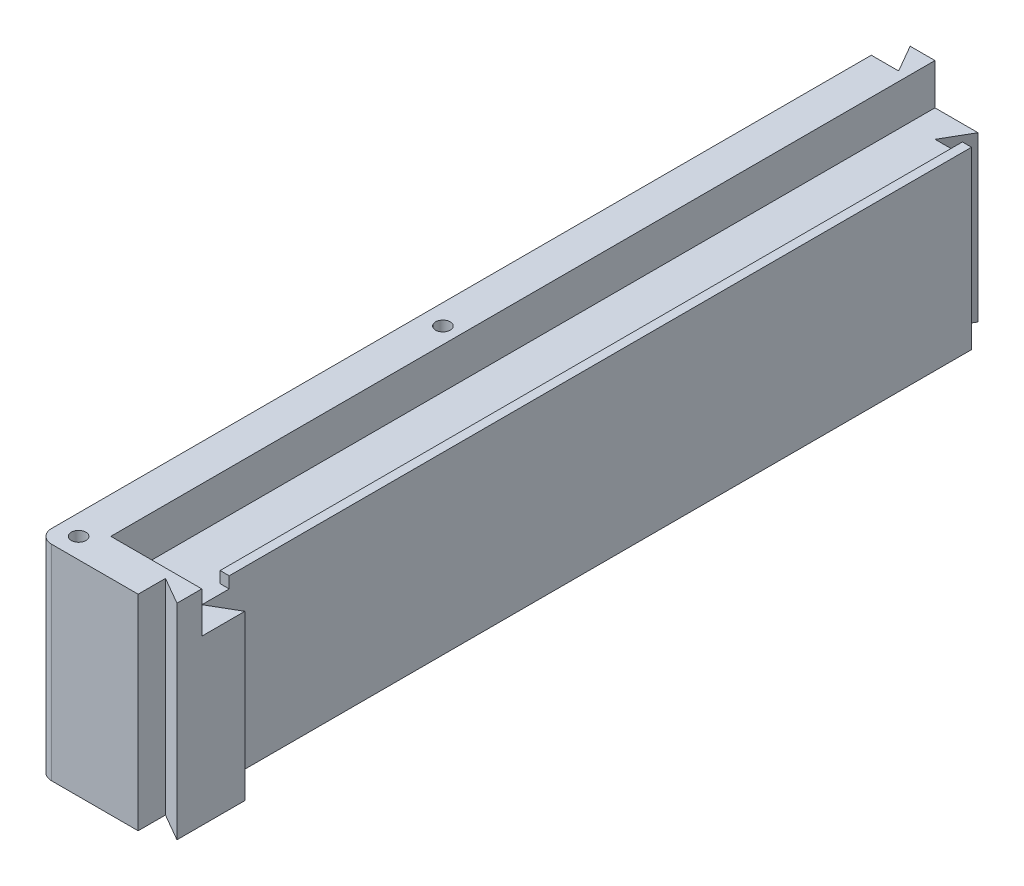
from build123d import *

# Parameters (mm, degrees)
SKETCH_1_W                = 270
SKETCH_1_H                = 370
SKETCH_1_W_2              = 250
SKETCH_1_H_2              = 350
EXTRUDE_2_DEPTH           = 45
SKETCH_4_W                = 250
SKETCH_4_H                = 350
SKETCH_4_W_2              = 222
SKETCH_4_H_2              = 322
EXTRUDE_3_DEPTH           = 5
SKETCH_9_W                = 246
SKETCH_9_H                = 346
SKETCH_9_W_2              = 226
SKETCH_9_H_2              = 326
CUT_EXTRUDE_3_DEPTH       = 2.5
SKETCH_12_R               = 1.6
CUT_EXTRUDE_5_DEPTH       = 109.5
FILLET_1_R                = 5
SKETCH_13_W               = 250
SKETCH_13_H               = 350
SKETCH_13_W_2             = 222
SKETCH_13_H_2             = 322
EXTRUDE_4_DEPTH           = 33.5
CUT_EXTRUDE_START         = -126.5
SKETCH_14_R               = 1.6
CUT_EXTRUDE_9_DEPTH       = 126.5
SKETCH_15_R               = 1.6
CUT_EXTRUDE_10_DEPTH      = 50
CUT_EXTRUDE_11_DEPTH      = 2.5
CUT_EXTRUDE_12_DEPTH      = 188.55314569
CUT_EXTRUDE_12_DEPTH_BACK = 188.55314569


with BuildPart() as part:
    # 草图1 → 凸台-拉伸2 (new body)
    with BuildSketch(Plane(origin=(0, 0, 0), x_dir=(1, 0, 0), z_dir=(0, 1, 0))):
        with Locations((125, 175)):
            Rectangle(SKETCH_1_W, SKETCH_1_H)
        with Locations((125, 175)):
            Rectangle(SKETCH_1_W_2, SKETCH_1_H_2, mode=Mode.SUBTRACT)
    extrude(amount=EXTRUDE_2_DEPTH)

    # 草图4 → 凸台-拉伸3 (add)
    with BuildSketch(Plane(origin=(0, 38.5, 0), x_dir=(1, 0, 0), z_dir=(0, 1, 0))):
        with Locations((125, 175)):
            Rectangle(SKETCH_4_W, SKETCH_4_H)
        with Locations((125, 175)):
            Rectangle(SKETCH_4_W_2, SKETCH_4_H_2, mode=Mode.SUBTRACT)
    extrude(amount=-EXTRUDE_3_DEPTH)

    # 草图9 → 切除-拉伸3 (cut)
    with BuildSketch(Plane(origin=(0, 38.5, 0), x_dir=(1, 0, 0), z_dir=(0, 1, 0))):
        with Locations((125, 175)):
            Rectangle(SKETCH_9_W, SKETCH_9_H)
        with Locations((125, 175)):
            Rectangle(SKETCH_9_W_2, SKETCH_9_H_2, mode=Mode.SUBTRACT)
    extrude(amount=-CUT_EXTRUDE_3_DEPTH, mode=Mode.SUBTRACT)

    # 草图12 → 切除-拉伸5 (cut)
    with BuildSketch(Plane(origin=(0, 45, 0), x_dir=(1, 0, 0), z_dir=(0, 1, 0))):
        with Locations(Location((-3.535533906, -3.535533906, 0), (0, 0, 270))):
            Circle(SKETCH_12_R)
        with BuildLine():
            ThreePointArc((-4.666904756, 354.666904756), (-4.666904756, 352.404163056), (-2.404163056, 352.404163056))
            Line((-2.404163056, 352.404163056), (-4.666904756, 354.666904756))
        make_face()
        with BuildLine():
            Line((-4.666904756, 354.666904756), (-2.404163056, 352.404163056))
            ThreePointArc((-2.404163056, 352.404163056), (-2.057326654, 352.923240414), (-1.935533906, 353.535533906))
            ThreePointArc((-1.935533906, 353.535533906), (-2.923240414, 355.013741158), (-4.666904756, 354.666904756))
        make_face()
        with Locations(Location((253.535533906, 353.535533906, 0), (0, 0, 270))):
            Circle(SKETCH_12_R)
        with Locations(Location((253.535533906, -3.535533906, 0), (0, 0, 270))):
            Circle(SKETCH_12_R)
    extrude(amount=-CUT_EXTRUDE_5_DEPTH, mode=Mode.SUBTRACT)

    # 圆角1
    fillet_1_edges = [part.edges().sort_by_distance(p)[0] for p in [
        (-10, 22.5, 10),
        (-10, 22.5, -360),
        (260, 22.5, -360),
        (260, 22.5, 10),
    ]]
    fillet(fillet_1_edges, radius=FILLET_1_R)

    # 草图13 → 凸台-拉伸4 (add)
    with BuildSketch(Plane.XZ.offset(-33.5)):
        with Locations((125, -175)):
            Rectangle(SKETCH_13_W, SKETCH_13_H)
        with Locations((125, -175)):
            Rectangle(SKETCH_13_W_2, SKETCH_13_H_2, mode=Mode.SUBTRACT)
    extrude(amount=EXTRUDE_4_DEPTH)

    # 草图14 → 切除-拉伸9 (cut)
    # profile 1 of 8: a face of its own
    with BuildSketch(Plane.XZ.offset(CUT_EXTRUDE_START)):
        with BuildLine():
            Line((14, -336), (14, -175))
            Line((14, -175), (6, -175))
            Line((6, -175), (9.45, -180.975575286))
            Line((9.45, -180.975575286), (-5.45, -180.975575286))
            Line((-5.45, -180.975575286), (-2, -175))
            Line((-2, -175), (-10, -175))
            Line((-10, -175), (-10, -355))
            ThreePointArc((-10, -355), (-8.535533906, -358.535533906), (-5, -360))
            Line((-5, -360), (14, -360))
            Line((14, -360), (14, -352))
            Line((14, -352), (14, -344))
            Line((14, -344), (14, -336))
        make_face()
        with Locations((-3.535533906, -353.535533906)):
            Circle(SKETCH_14_R, mode=Mode.SUBTRACT)
    # profile 2 of 8: a face of its own
    with BuildSketch(Plane.XZ.offset(CUT_EXTRUDE_START)):
        Polygon((14, -6), (14, -14), (125, -14), (125, 10), (14, 10), (14, 2), (19.975575286, 5.45), (19.975575286, -9.45), align=None)
    # profile 3 of 8: a face of its own
    with BuildSketch(Plane.XZ.offset(CUT_EXTRUDE_START)):
        Polygon((125, 10), (125, -14), (236, -14), (236, -6), (230.024424714, -9.45), (230.024424714, 5.45), (236, 2), (236, 10), align=None)
    # profile 4 of 8: a face of its own
    with BuildSketch(Plane.XZ.offset(CUT_EXTRUDE_START)):
        with BuildLine():
            Line((236, -336), (14, -336))
            Line((14, -336), (14, -344))
            Line((14, -344), (19.975575286, -340.55))
            Line((19.975575286, -340.55), (19.975575286, -355.45))
            Line((19.975575286, -355.45), (14, -352))
            Line((14, -352), (14, -360))
            Line((14, -360), (255, -360))
            ThreePointArc((255, -360), (258.535533906, -358.535533906), (260, -355))
            Line((260, -355), (260, 5))
            ThreePointArc((260, 5), (258.535533906, 8.535533906), (255, 10))
            Line((255, 10), (236, 10))
            Line((236, 10), (236, 2))
            Line((236, 2), (236, -6))
            Line((236, -6), (236, -14))
            Line((236, -14), (236, -336))
        make_face()
        with Locations((253.535533906, -353.535533906)):
            Circle(SKETCH_14_R, mode=Mode.SUBTRACT)
        with Locations((253.535533906, 3.535533906)):
            Circle(SKETCH_14_R, mode=Mode.SUBTRACT)
    # profile 5 of 8: a face of its own
    with BuildSketch(Plane.XZ.offset(CUT_EXTRUDE_START)):
        Polygon((230.024424714, -9.45), (236, -6), (236, 2), (230.024424714, 5.45), align=None)
    # profile 6 of 8: a face of its own
    with BuildSketch(Plane.XZ.offset(CUT_EXTRUDE_START)):
        with Locations((253.535533906, -353.535533906)):
            Circle(SKETCH_14_R)
    # profile 7 of 8: a face of its own
    with BuildSketch(Plane.XZ.offset(CUT_EXTRUDE_START)):
        Polygon((19.975575286, -340.55), (14, -344), (14, -352), (19.975575286, -355.45), align=None)
    # profile 8 of 8: a face of its own
    with BuildSketch(Plane.XZ.offset(CUT_EXTRUDE_START)):
        with Locations((-3.535533906, -353.535533906)):
            Circle(SKETCH_14_R)
    extrude(amount=CUT_EXTRUDE_9_DEPTH, mode=Mode.SUBTRACT)

    # 草图15 → 切除-拉伸10 (cut)
    with BuildSketch(Plane(origin=(0, 45, 0), x_dir=(1, 0, 0), z_dir=(0, 1, 0))):
        with Locations(Location((-3.535533906, 76.464466094, 0), (0, 0, 270))):
            Circle(SKETCH_15_R)
    extrude(amount=-CUT_EXTRUDE_10_DEPTH, mode=Mode.SUBTRACT)

    # 草图16 → 切除-拉伸11 (cut)
    with BuildSketch(Plane(origin=(0, 38.5, 0), x_dir=(1, 0, 0), z_dir=(0, 1, 0))):
        Polygon((0, 0), (19.975575286, 0), (19.975575286, 2), (2, 2), (2, 180.975575286), (0, 180.975575286), align=None)
    extrude(amount=-CUT_EXTRUDE_11_DEPTH, mode=Mode.SUBTRACT)

    # 草图18 → 切除-拉伸12 (cut, two sides: drawn at the far end of the back side and taken through both)
    with BuildSketch(Plane(origin=(0, 45, 0), x_dir=(1, 0, 0), z_dir=(0, 1, 0)).offset(-CUT_EXTRUDE_12_DEPTH_BACK)):
        with BuildLine():
            Line((14, -10), (14, -8))
            Line((14, -8), (12, -8))
            Line((12, -8), (-5, -8))
            ThreePointArc((-5, -8), (-7.121320344, -7.121320344), (-8, -5))
            Line((-8, -5), (-8, 173))
            Line((-8, 173), (-8, 175))
            Line((-8, 175), (-10, 175))
            Line((-10, 175), (-10, -5))
            ThreePointArc((-10, -5), (-8.535533906, -8.535533906), (-5, -10))
            Line((-5, -10), (14, -10))
        make_face()
    extrude(amount=CUT_EXTRUDE_12_DEPTH + CUT_EXTRUDE_12_DEPTH_BACK, mode=Mode.SUBTRACT)


solid = part.part
